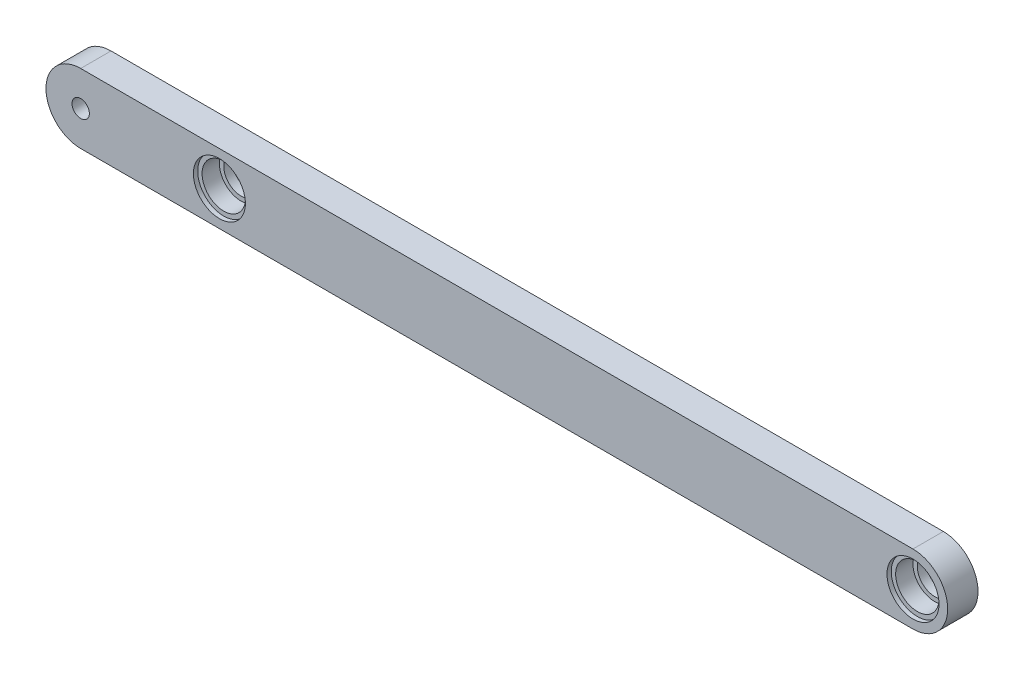
from build123d import *

# Parameters (mm, degrees)
EXTRUDE_1_DEPTH     = 3.5
SKETCH_2_R          = 2
CUT_EXTRUDE_1_DEPTH = 105.135728739
SKETCH_2_3_R        = 2.5
SKETCH_2_3_R_2      = 2
CUT_EXTRUDE_2_DEPTH = 2.5
SKETCH_2_4_R        = 3
SKETCH_2_4_R_2      = 2.5
CUT_EXTRUDE_3_DEPTH = 0.5
CUT_EXTRUDE_4_DEPTH = 105.135728739
CUT_EXTRUDE_5_DEPTH = 2.5
CUT_EXTRUDE_6_DEPTH = 0.5
SKETCH_5_R          = 1
CUT_EXTRUDE_8_DEPTH = 105.135728739
CUT_EXTRUDE_9_DEPTH = 105.135728739


with BuildPart() as part:
    # 草图1 → 凸台-拉伸1 (new body)
    with BuildSketch(Plane.XY):
        with BuildLine():
            Line((0, 4), (100, 4))
            ThreePointArc((100, 4), (104, 0), (100, -4))
            Line((100, -4), (0, -4))
            ThreePointArc((0, -4), (-4, 0), (0, 4))
        make_face()
    extrude(amount=EXTRUDE_1_DEPTH)

    # 草图2 → 切除-拉伸1 (cut, through all)
    with BuildSketch(Plane.XY.offset(3.5)):
        with Locations((100, 0)):
            Circle(SKETCH_2_R)
    extrude(amount=-CUT_EXTRUDE_1_DEPTH, mode=Mode.SUBTRACT)

    # 草图2<3> → 切除-拉伸2 (cut)
    with BuildSketch(Plane.XY.offset(3.5)):
        with Locations((100, 0)):
            Circle(SKETCH_2_3_R)
        with Locations((100, 0)):
            Circle(SKETCH_2_3_R_2, mode=Mode.SUBTRACT)
    extrude(amount=-CUT_EXTRUDE_2_DEPTH, mode=Mode.SUBTRACT)

    # 草图2<4> → 切除-拉伸3 (cut)
    with BuildSketch(Plane.XY.offset(3.5)):
        with Locations((100, 0)):
            Circle(SKETCH_2_4_R)
        with Locations((100, 0)):
            Circle(SKETCH_2_4_R_2, mode=Mode.SUBTRACT)
    extrude(amount=-CUT_EXTRUDE_3_DEPTH, mode=Mode.SUBTRACT)

    # 草图3 → 切除-拉伸4 (cut, through all)
    with BuildSketch(Plane.XY.offset(3.5)):
        with BuildLine():
            ThreePointArc((22, 0), (20, 2), (18, 0))
            ThreePointArc((18, 0), (20, -2), (22, 0))
        make_face()
    extrude(amount=-CUT_EXTRUDE_4_DEPTH, mode=Mode.SUBTRACT)

    # 草图3<3> → 切除-拉伸5 (cut)
    with BuildSketch(Plane.XY.offset(3.5)):
        with BuildLine():
            ThreePointArc((22.5, 0), (20, 2.5), (17.5, 0))
            ThreePointArc((17.5, 0), (20, -2.5), (22.5, 0))
        make_face()
        with BuildLine():
            ThreePointArc((22, 0), (20, -2), (18, 0))
            ThreePointArc((18, 0), (20, 2), (22, 0))
        make_face(mode=Mode.SUBTRACT)
    extrude(amount=-CUT_EXTRUDE_5_DEPTH, mode=Mode.SUBTRACT)

    # 草图3<4> → 切除-拉伸6 (cut)
    with BuildSketch(Plane.XY.offset(3.5)):
        with BuildLine():
            ThreePointArc((23, 0), (20, 3), (17, 0))
            ThreePointArc((17, 0), (20, -3), (23, 0))
        make_face()
        with BuildLine():
            ThreePointArc((22.5, 0), (20, -2.5), (17.5, 0))
            ThreePointArc((17.5, 0), (20, 2.5), (22.5, 0))
        make_face(mode=Mode.SUBTRACT)
    extrude(amount=-CUT_EXTRUDE_6_DEPTH, mode=Mode.SUBTRACT)

    # 草图5 → 切除-拉伸8 (cut, through all)
    with BuildSketch(Plane.XY.offset(3.5)):
        with Locations((4, 0)):
            Circle(SKETCH_5_R)
    extrude(amount=-CUT_EXTRUDE_8_DEPTH, mode=Mode.SUBTRACT)

    # 草图6 → 切除-拉伸9 (cut, through all)
    with BuildSketch(Plane.XY.offset(3.5)):
        with BuildLine():
            Line((0, 4), (4, 4))
            ThreePointArc((4, 4), (0, 0), (4, -4))
            Line((4, -4), (0, -4))
            ThreePointArc((0, -4), (-4, 0), (0, 4))
        make_face()
    extrude(amount=-CUT_EXTRUDE_9_DEPTH, mode=Mode.SUBTRACT)


solid = part.part
